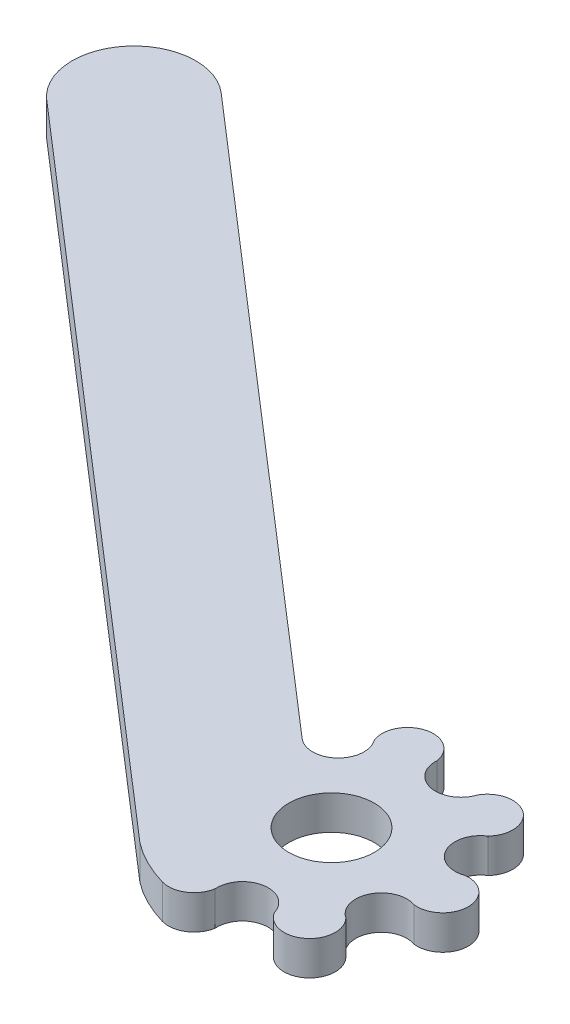
from build123d import *

# Parameters (mm, degrees)
EXTRUDE_1_DEPTH     = 2
SKETCH_2_R          = 2.5
CUT_EXTRUDE_1_DEPTH = 59.113082246


with BuildPart() as part:
    # Эскиз1 → Бобышка-Вытянуть1 (new body)
    with BuildSketch(Plane(origin=(0, 0, 0), x_dir=(1, 0, 0), z_dir=(0, 1, 0))):
        with BuildLine():
            Line((-5.373970273, 3.656561705), (-40.455802455, 34.00041309))
            ThreePointArc((-40.455802455, 34.00041309), (-45.556108034, 33.631060436), (-45.18675538, 28.530754857))
            Line((-45.18675538, 28.530754857), (-4.813797954, -6.389628256))
            ThreePointArc((-4.813797954, -6.389628256), (-3.570215935, -7.159159041), (-2.207328799, -7.689453789))
            ThreePointArc((-2.207328799, -7.689453789), (-0.992008234, -7.515625856), (-0.313557112, -6.492432667))
            ThreePointArc((-0.313557112, -6.492432667), (0.909859751, -4.914690841), (2.617012816, -5.949894446))
            ThreePointArc((2.617012816, -5.949894446), (4.813797954, -6.389628256), (4.997119526, -4.156777171))
            ThreePointArc((4.997119526, -4.156777171), (4.474545709, -2.231241963), (6.326923077, -1.489981335))
            ThreePointArc((6.326923077, -1.489981335), (8, 0), (6.326923077, 1.489981335))
            ThreePointArc((6.326923077, 1.489981335), (4.474545709, 2.231241963), (4.997119526, 4.156777171))
            ThreePointArc((4.997119526, 4.156777171), (4.813797954, 6.389628256), (2.617012816, 5.949894446))
            ThreePointArc((2.617012816, 5.949894446), (0.910344036, 4.916428962), (-0.31314214, 6.492452695))
            ThreePointArc((-0.31314214, 6.492452695), (-2.206837314, 7.689594857), (-3.177480342, 5.670416094))
            ThreePointArc((-3.177480342, 5.670416094), (-3.378992644, 3.685431957), (-5.373970273, 3.656561705))
        make_face()
    extrude(amount=EXTRUDE_1_DEPTH)

    # Эскиз2 → Вырез-Вытянуть1 (cut, through all)
    with BuildSketch(Plane(origin=(0, 2, 0), x_dir=(1, 0, 0), z_dir=(0, 1, 0))):
        with Locations(Location((0, 0, 0), (0, 0, 270))):
            Circle(SKETCH_2_R)
    extrude(amount=-CUT_EXTRUDE_1_DEPTH, mode=Mode.SUBTRACT)


solid = part.part
